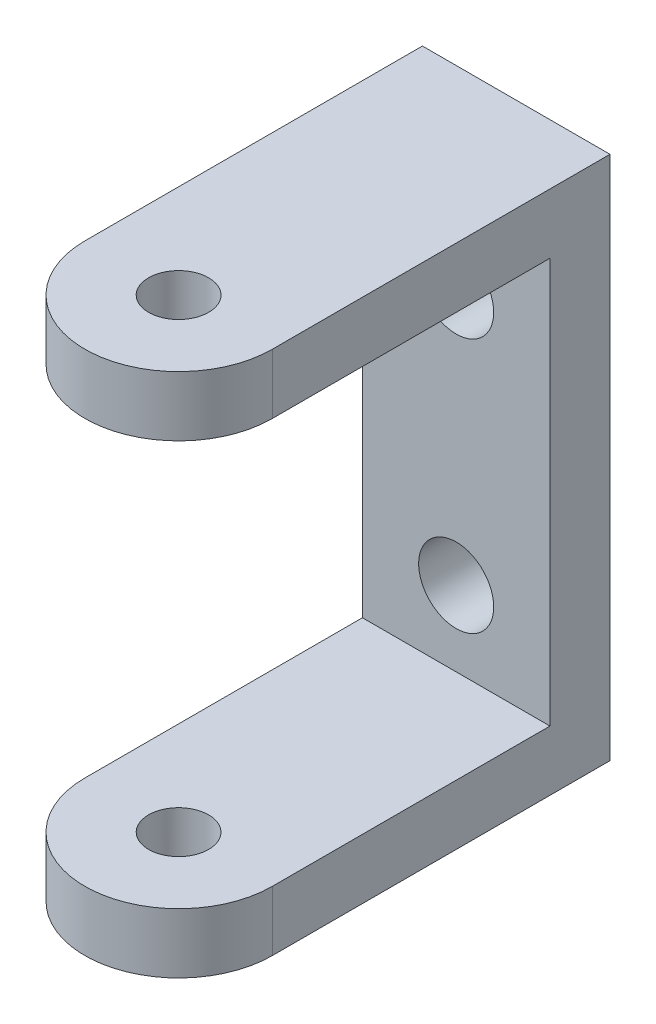
from build123d import *

# Parameters (mm, degrees)
SCHIZZO1_W                   = 25
SCHIZZO1_H                   = 70
ESTRUSIONE_ESTRUSIONE1_DEPTH = 8
SCHIZZO2_W                   = 25
SCHIZZO2_H                   = 8
ESTRUSIONE_ESTRUSIONE2_DEPTH = 49.5
SCHIZZO3_R                   = 4
TAGLIO_ESTRUSIONE1_DEPTH     = 70
SCHIZZO4_R                   = 5
TAGLIO_ESTRUSIONE2_DEPTH     = 8


with BuildPart() as part:
    # Schizzo1 → Estrusione-Estrusione1 (new body)
    with BuildSketch(Plane.XY):
        Rectangle(SCHIZZO1_W, SCHIZZO1_H)
    extrude(amount=ESTRUSIONE_ESTRUSIONE1_DEPTH)

    # Schizzo2 → Estrusione-Estrusione2 (add)
    with BuildSketch(Plane.XY.offset(8)):
        with Locations((0, 31)):
            Rectangle(SCHIZZO2_W, SCHIZZO2_H)
        with Locations((0, -31)):
            Rectangle(SCHIZZO2_W, SCHIZZO2_H)
    extrude(amount=ESTRUSIONE_ESTRUSIONE2_DEPTH)

    # Schizzo3 → Taglio-Estrusione1 (cut)
    with BuildSketch(Plane(origin=(0, 35, 0), x_dir=(1, 0, 0), z_dir=(0, 1, 0))):
        with BuildLine():
            ThreePointArc((6.3e-08, -57.5), (-8.838834742, -53.838834787), (-12.5, -45))
            Line((-12.5, -45), (-12.5, -57.5))
            Line((-12.5, -57.5), (6.3e-08, -57.5))
        make_face()
        with BuildLine():
            ThreePointArc((12.5, -45), (8.838834787, -53.838834742), (6.3e-08, -57.5))
            Line((6.3e-08, -57.5), (12.5, -57.5))
            Line((12.5, -57.5), (12.5, -45))
        make_face()
        with Locations(Location((0, -45, 0), (0, 0, 180))):
            Circle(SCHIZZO3_R)
    extrude(amount=-TAGLIO_ESTRUSIONE1_DEPTH, mode=Mode.SUBTRACT)

    # Schizzo4 → Taglio-Estrusione2 (cut)
    with BuildSketch(Plane.XY.offset(8)):
        with Locations((0, 17)):
            Circle(SCHIZZO4_R)
        with Locations((0, -17)):
            Circle(SCHIZZO4_R)
    extrude(amount=-TAGLIO_ESTRUSIONE2_DEPTH, mode=Mode.SUBTRACT)


solid = part.part
